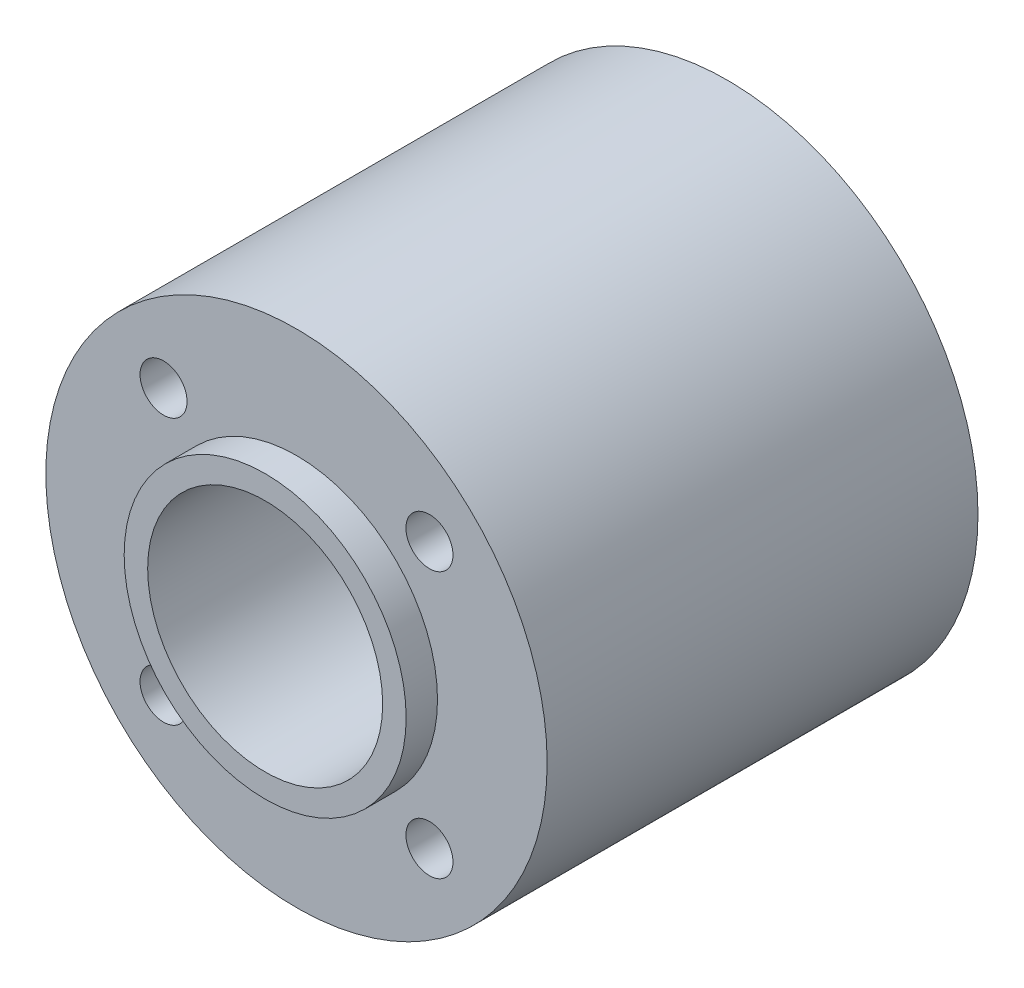
from build123d import *

# Parameters (mm, degrees)
ESQUISSE1_R             = 16
ESQUISSE1_R_2           = 9
ESQUISSE1_R_3           = 7.5
BOSS_EXTRU_2_DEPTH      = 27.5
BOSS_EXTRU_3_START      = -2
ESQUISSE1_5_R           = 9
ESQUISSE1_5_R_2         = 7.5
BOSS_EXTRU_3_DEPTH      = 2
BOSS_EXTRU_4_START      = 27.5
ESQUISSE1_7_R           = 9
ESQUISSE1_7_R_2         = 7.5
BOSS_EXTRU_4_DEPTH      = 2
ESQUISSE2_R             = 1.5
ENL_V_MAT_EXTRU_1_DEPTH = 38.17862289


with BuildPart() as part:
    # Esquisse1 → Boss.-Extru.2 (new body)
    # profile 1 of 2: a face of its own
    with BuildSketch(Plane.XY):
        Circle(ESQUISSE1_R)
        Circle(ESQUISSE1_R_2, mode=Mode.SUBTRACT)
    # profile 2 of 2: a face of its own
    with BuildSketch(Plane.XY):
        Circle(ESQUISSE1_R_2)
        Circle(ESQUISSE1_R_3, mode=Mode.SUBTRACT)
    extrude(amount=BOSS_EXTRU_2_DEPTH)

    # Esquisse1<5> → Boss.-Extru.3 (add)
    with BuildSketch(Plane.XY.offset(BOSS_EXTRU_3_START)):
        Circle(ESQUISSE1_5_R)
        Circle(ESQUISSE1_5_R_2, mode=Mode.SUBTRACT)
    extrude(amount=BOSS_EXTRU_3_DEPTH)

    # Esquisse1<7> → Boss.-Extru.4 (add)
    with BuildSketch(Plane.XY.offset(BOSS_EXTRU_4_START)):
        Circle(ESQUISSE1_7_R)
        Circle(ESQUISSE1_7_R_2, mode=Mode.SUBTRACT)
    extrude(amount=BOSS_EXTRU_4_DEPTH)

    # Esquisse2 → Enlèv. mat.-Extru.1 (cut, through all)
    with BuildSketch(Plane(origin=(0, 0, 0), x_dir=(-1, 0, 0), z_dir=(0, 0, -1))):
        with Locations((-8.485281374, 8.485281374)):
            Circle(ESQUISSE2_R)
        with Locations((8.485281374, 8.485281374)):
            Circle(ESQUISSE2_R)
        with Locations((8.485281374, -8.485281374)):
            Circle(ESQUISSE2_R)
        with Locations((-8.485281374, -8.485281374)):
            Circle(ESQUISSE2_R)
    extrude(amount=-ENL_V_MAT_EXTRU_1_DEPTH, mode=Mode.SUBTRACT)


solid = part.part
